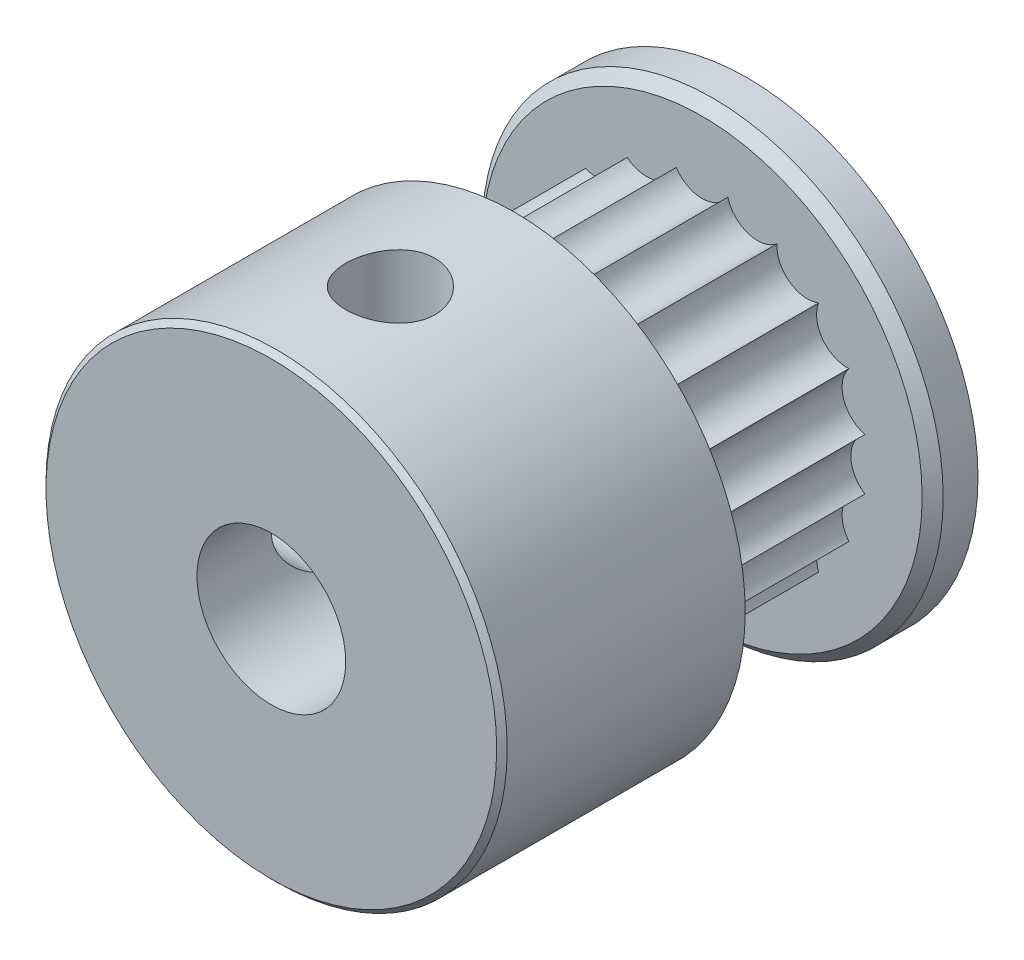
from build123d import *

# Parameters (mm, degrees)
SKETCH2_R           = 1.5
CUT_EXTRUDE1_DEPTH  = 29
CIRPATTERN1_COUNT   = 2
CIRPATTERN1_ANGLE   = 90
BOSS_EXTRUDE1_START = 6.3
SKETCH3_R           = 2.5
BOSS_EXTRUDE1_DEPTH = 6.3


with BuildPart() as part:
    # Sketch1 → Revolve1 (revolve)
    with BuildSketch(Plane(origin=(0, 0, 0), x_dir=(0, 0, -1), z_dir=(1, 0, 0)), mode=Mode.PRIVATE) as revolve1_sk:
        Polygon((-7.823223305, 7.75), (0.176776695, 7.75), (0.176776695, 5), (6.476776695, 5), (6.476776695, 7.396446609), (6.830330086, 7.75), (8, 7.75), (8, 2.5), (-8, 2.5), (-8, 7.573223305), align=None)
    revolve(revolve1_sk.sketch.rotate(Axis((0, 0, 8), (0, 0, -1)), 90), axis=Axis((0, 0, 8), (0, 0, -1)))

    # Sketch2 → Cut-Extrude1 (cut)
    with BuildSketch(Plane(origin=(0, 0, 0), x_dir=(1, 0, 0), z_dir=(0, 1, 0))):
        with Locations(Location((0, -4, 0), (0, 0, 90))):
            Circle(SKETCH2_R)
    cut_extrude1 = extrude(amount=CUT_EXTRUDE1_DEPTH, mode=Mode.SUBTRACT)

    # CirPattern1: Cut-Extrude1 ×2 about axis
    cirpattern1_axis = Axis((0, 0, 8), (0, 0, 1))
    for i in range(1, CIRPATTERN1_COUNT):
        add(cut_extrude1.rotate(cirpattern1_axis, i * CIRPATTERN1_ANGLE / (CIRPATTERN1_COUNT - 1)), mode=Mode.SUBTRACT)

    # Sketch3 → Boss-Extrude1 (add)
    with BuildSketch(Plane.XY.offset(-6.476776695).offset(BOSS_EXTRUDE1_START)):
        with BuildLine():
            ThreePointArc((-0.866608796, 5.471552596), (0, 5), (0.866608796, 5.471552596))
            ThreePointArc((0.866608796, 5.471552596), (1.545084972, 4.755282581), (2.51499668, 4.935958906))
            ThreePointArc((2.51499668, 4.935958906), (2.938926261, 4.045084972), (3.917199167, 3.917199167))
            ThreePointArc((3.917199167, 3.917199167), (4.045084972, 2.938926261), (4.935958906, 2.51499668))
            ThreePointArc((4.935958906, 2.51499668), (4.755282581, 1.545084972), (5.471552596, 0.866608796))
            ThreePointArc((5.471552596, 0.866608796), (5, 0), (5.471552596, -0.866608796))
            ThreePointArc((5.471552596, -0.866608796), (4.755282581, -1.545084972), (4.935958906, -2.51499668))
            ThreePointArc((4.935958906, -2.51499668), (4.045084972, -2.938926261), (3.917199167, -3.917199167))
            ThreePointArc((3.917199167, -3.917199167), (2.938926261, -4.045084972), (2.51499668, -4.935958906))
            ThreePointArc((2.51499668, -4.935958906), (1.545084972, -4.755282581), (0.866608796, -5.471552596))
            ThreePointArc((0.866608796, -5.471552596), (0, -5), (-0.866608796, -5.471552596))
            ThreePointArc((-0.866608796, -5.471552596), (-1.545084972, -4.755282581), (-2.51499668, -4.935958906))
            ThreePointArc((-2.51499668, -4.935958906), (-2.938926261, -4.045084972), (-3.917199167, -3.917199167))
            ThreePointArc((-3.917199167, -3.917199167), (-4.045084972, -2.938926261), (-4.935958906, -2.51499668))
            ThreePointArc((-4.935958906, -2.51499668), (-4.755282581, -1.545084972), (-5.471552596, -0.866608796))
            ThreePointArc((-5.471552596, -0.866608796), (-5, 0), (-5.471552596, 0.866608796))
            ThreePointArc((-5.471552596, 0.866608796), (-4.755282581, 1.545084972), (-4.935958906, 2.51499668))
            ThreePointArc((-4.935958906, 2.51499668), (-4.045084972, 2.938926261), (-3.917199167, 3.917199167))
            ThreePointArc((-3.917199167, 3.917199167), (-2.938926261, 4.045084972), (-2.51499668, 4.935958906))
            ThreePointArc((-2.51499668, 4.935958906), (-1.545084972, 4.755282581), (-0.866608796, 5.471552596))
        make_face()
        Circle(SKETCH3_R, mode=Mode.SUBTRACT)
    extrude(amount=-BOSS_EXTRUDE1_DEPTH)


solid = part.part
